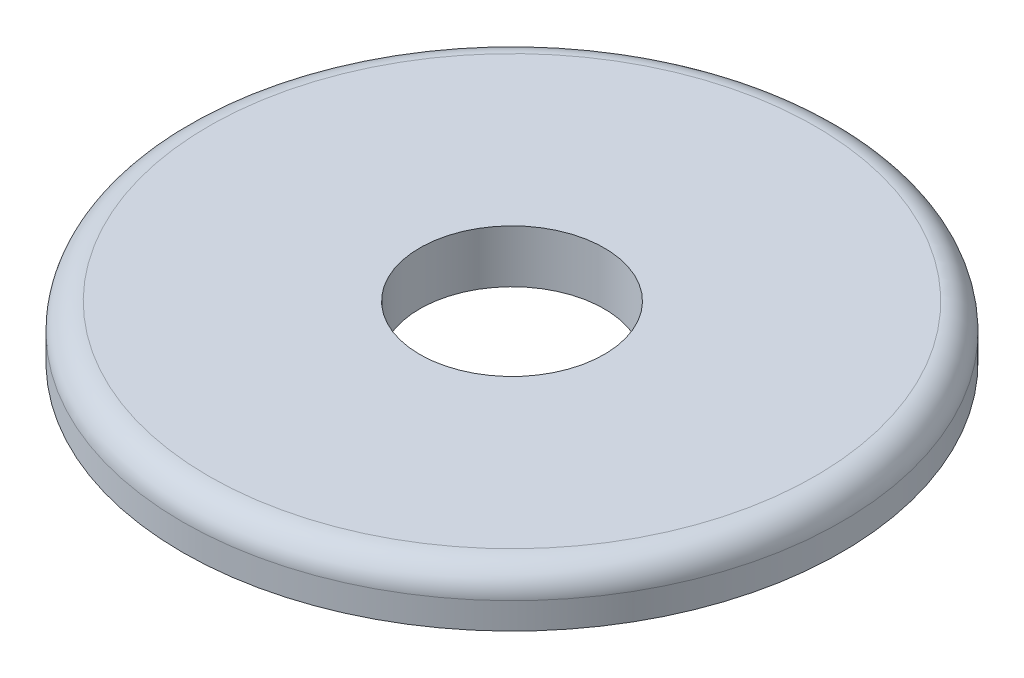
from build123d import *

# Parameters (mm, degrees)
SKETCH1_R           = 12.5
SKETCH1_R_2         = 3.5
BOSS_EXTRUDE1_DEPTH = 2
FILLET1_R           = 1


with BuildPart() as part:
    # Sketch1 → Boss-Extrude1 (new body)
    with BuildSketch(Plane(origin=(0, 0, 0), x_dir=(1, 0, 0), z_dir=(0, 1, 0))):
        with Locations(Location((0, 0, 0), (0, 0, 270))):
            Circle(SKETCH1_R)
        with Locations(Location((0, 0, 0), (0, 0, 270))):
            Circle(SKETCH1_R_2, mode=Mode.SUBTRACT)
    extrude(amount=BOSS_EXTRUDE1_DEPTH)

    # Fillet1
    fillet1_edges = [part.edges().sort_by_distance(p)[0] for p in [
        (0, 2, -12.5),
    ]]
    fillet(fillet1_edges, radius=FILLET1_R)


solid = part.part
